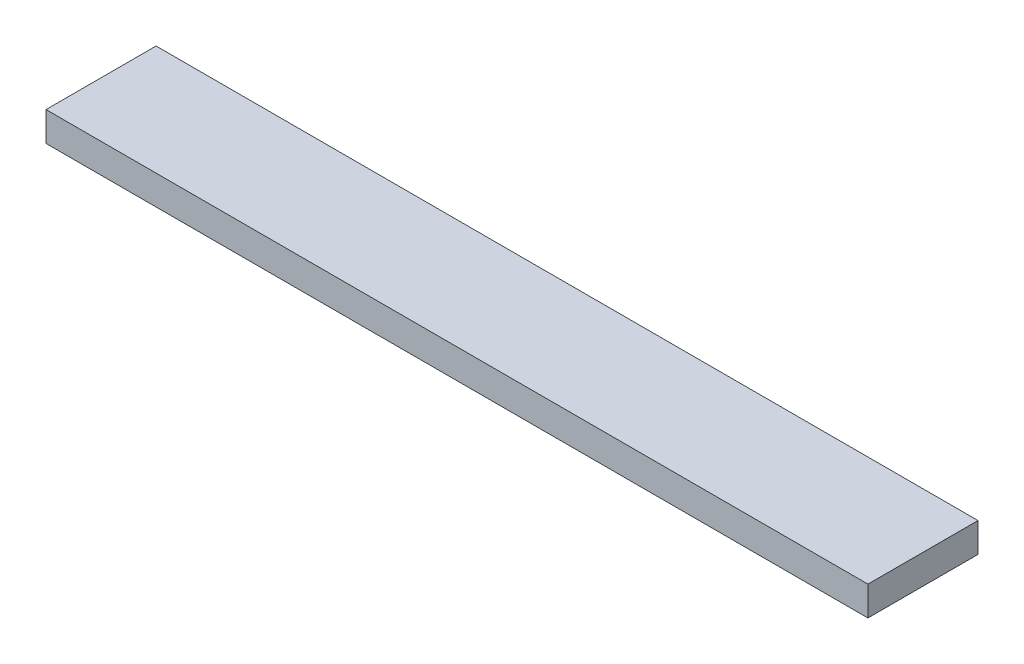
from build123d import *

# Parameters (mm, degrees)
SKETCH1_W           = 112
SKETCH1_H           = 15
BOSS_EXTRUDE1_DEPTH = 4


with BuildPart() as part:
    # Sketch1 → Boss-Extrude1 (new body)
    with BuildSketch(Plane(origin=(0, 0, 0), x_dir=(1, 0, 0), z_dir=(0, 1, 0))):
        Rectangle(SKETCH1_W, SKETCH1_H)
    extrude(amount=BOSS_EXTRUDE1_DEPTH)


solid = part.part
